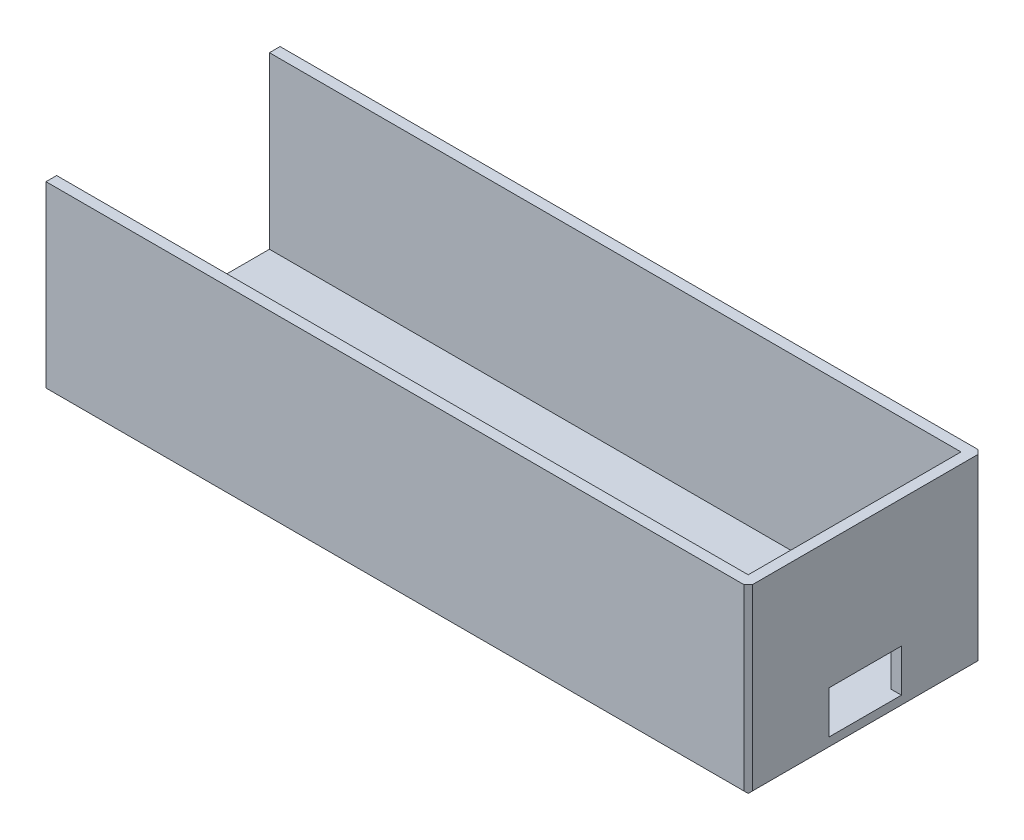
from build123d import *

# Parameters (mm, degrees)
SKETCH_1_W             = 160
SKETCH_1_H             = 50
EXTRUDE_1_DEPTH        = 3
EXTRUDE_1_2_DEPTH      = 40
EXTRUDE_1_2_DEPTH_BACK = 3
SKETCH_3_W             = 165
SKETCH_3_H             = 55
SKETCH_3_W_2           = 160
SKETCH_3_H_2           = 50
SKETCH_4_W             = 50
SKETCH_4_H             = 40
CUT_EXTRUDE_1_DEPTH    = 100
CHAMFER_1_SIZE         = 1
CHAMFER_2_SIZE         = 1
SKETCH_1_4_R           = 4
EXTRUDE_8_DEPTH        = 5
SKETCH_8_W             = 8.5
SKETCH_8_H             = 10
CUT_EXTRUDE_3_DEPTH    = 10


with BuildPart() as part:
    # 草图1 → Extrude 1 (new body)
    with BuildSketch(Plane(origin=(0, 0, 0), x_dir=(1, 0, 0), z_dir=(0, 1, 0))):
        with Locations((80, -25)):
            Rectangle(SKETCH_1_W, SKETCH_1_H)
    extrude(amount=EXTRUDE_1_DEPTH)



with BuildPart() as body_2:
    # 草图3 → Extrude 1 2 (new, two sides: drawn at the far end of the back side and taken through both)
    with BuildSketch(Plane(origin=(0, 3, 0), x_dir=(1, 0, 0), z_dir=(0, 1, 0)).offset(-EXTRUDE_1_2_DEPTH_BACK)):
        with Locations((80, -25)):
            Rectangle(SKETCH_3_W, SKETCH_3_H)
        with Locations((80, -25)):
            Rectangle(SKETCH_3_W_2, SKETCH_3_H_2, mode=Mode.SUBTRACT)
    extrude(amount=EXTRUDE_1_2_DEPTH + EXTRUDE_1_2_DEPTH_BACK)

    # 草图4 → 切除-拉伸1 (cut)
    with BuildSketch(Plane.ZY.offset(2.5)):
        with Locations((25, 23)):
            Rectangle(SKETCH_4_W, SKETCH_4_H)
    extrude(amount=-CUT_EXTRUDE_1_DEPTH, mode=Mode.SUBTRACT)

    # 倒角1
    chamfer_1_edges = [body_2.edges().sort_by_distance(p)[0] for p in [
        (162.5, 0, 25),
        (80, 0, -2.5),
        (-2.5, 0, 25),
        (80, 0, 52.5),
    ]]
    chamfer(chamfer_1_edges, length=CHAMFER_1_SIZE)

    # 倒角2
    chamfer_2_edges = [body_2.edges().sort_by_distance(p)[0] for p in [
        (162.5, 22, -2.5),
        (162.5, 22, 52.5),
    ]]
    chamfer(chamfer_2_edges, length=CHAMFER_2_SIZE)


with BuildPart() as part_1:
    add(part.part)

    add(body_2.part)  # 凸台-拉伸8 merges body 2
    # 草图1<4> → 凸台-拉伸8 (add)
    with BuildSketch(Plane(origin=(0, 0, 0), x_dir=(1, 0, 0), z_dir=(0, 1, 0))):
        with BuildLine():
            Line((61, 10), (61, 0))
            Line((61, 0), (70, 0))
            Line((70, 0), (79, 0))
            Line((79, 0), (79, 10))
            ThreePointArc((79, 10), (70, 19), (61, 10))
        make_face()
        with Locations(Location((70, 10, 0), (0, 0, 270))):
            Circle(SKETCH_1_4_R, mode=Mode.SUBTRACT)
    extrude(amount=EXTRUDE_8_DEPTH)

    # 草图8 → 切除-拉伸3 (cut)
    with BuildSketch(Plane(origin=(162.5, 0, 0), x_dir=(0, 0, -1), z_dir=(1, 0, 0))):
        with Locations((-20.75, 8)):
            Rectangle(SKETCH_8_W, SKETCH_8_H)
        with Locations((-29.25, 8)):
            Rectangle(SKETCH_8_W, SKETCH_8_H)
    extrude(amount=-CUT_EXTRUDE_3_DEPTH, mode=Mode.SUBTRACT)


solid = part_1.part
